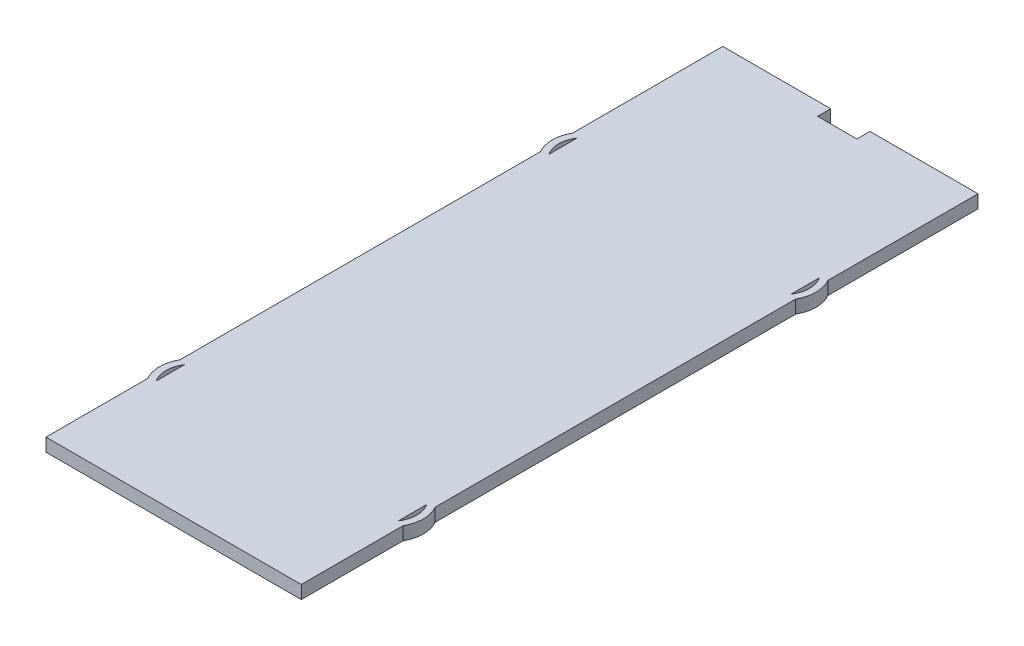
from build123d import *

# Parameters (mm, degrees)
SKETCH1_R             = 4.95
BOSS_EXTRUDE1_DEPTH   = 2
BOSS_EXTRUDE1_2_DEPTH = 2
BOSS_EXTRUDE1_3_DEPTH = 2
BOSS_EXTRUDE1_4_DEPTH = 2
SKETCH2_W             = 39
SKETCH2_H             = 103.4
BOSS_EXTRUDE2_DEPTH   = 2
SKETCH3_W             = 6
SKETCH3_H             = 2
CUT_EXTRUDE1_DEPTH    = 88.767775977
CUT_EXTRUDE2_DEPTH    = 88.767775977


with BuildPart() as part:
    # Sketch1 → Boss-Extrude1 (new body)
    with BuildSketch(Plane(origin=(0, 0, 0), x_dir=(1, 0, 0), z_dir=(0, 1, 0))):
        with Locations(Location((-15.2, 60, 0), (0, 0, 270))):
            Circle(SKETCH1_R)
    extrude(amount=BOSS_EXTRUDE1_DEPTH)



with BuildPart() as body_2:
    # Sketch1 → Boss-Extrude1 2 (new body)
    with BuildSketch(Plane(origin=(0, 0, 0), x_dir=(1, 0, 0), z_dir=(0, 1, 0))):
        with Locations(Location((15.2, 60, 0), (0, 0, 270))):
            Circle(SKETCH1_R)
    extrude(amount=BOSS_EXTRUDE1_2_DEPTH)


with BuildPart() as body_3:
    # Sketch1 → Boss-Extrude1 3 (new body)
    with BuildSketch(Plane(origin=(0, 0, 0), x_dir=(1, 0, 0), z_dir=(0, 1, 0))):
        with Locations(Location((15.2, 0, 0), (0, 0, 270))):
            Circle(SKETCH1_R)
    extrude(amount=BOSS_EXTRUDE1_3_DEPTH)


with BuildPart() as body_4:
    # Sketch1 → Boss-Extrude1 4 (new body)
    with BuildSketch(Plane(origin=(0, 0, 0), x_dir=(1, 0, 0), z_dir=(0, 1, 0))):
        with Locations(Location((-15.2, 0, 0), (0, 0, 270))):
            Circle(SKETCH1_R)
    extrude(amount=BOSS_EXTRUDE1_4_DEPTH)


with BuildPart() as part_1:
    add(part.part)

    add(body_2.part)  # Boss-Extrude2 merges body 2

    add(body_3.part)  # Boss-Extrude2 merges body 3

    add(body_4.part)  # Boss-Extrude2 merges body 4
    # Sketch2 → Boss-Extrude2 (add)
    with BuildSketch(Plane(origin=(0, 2, 0), x_dir=(1, 0, 0), z_dir=(0, 1, 0))):
        with Locations((0, 33.7)):
            Rectangle(SKETCH2_W, SKETCH2_H)
    extrude(amount=-BOSS_EXTRUDE2_DEPTH)

    # Sketch3 → Cut-Extrude1 (cut, through all)
    with BuildSketch(Plane(origin=(0, 2, 0), x_dir=(1, 0, 0), z_dir=(0, 1, 0))):
        with Locations((0, 84.4)):
            Rectangle(SKETCH3_W, SKETCH3_H)
    extrude(amount=-CUT_EXTRUDE1_DEPTH, mode=Mode.SUBTRACT)

    # Sketch5 → Cut-Extrude2 (cut, through all)
    with BuildSketch(Plane.XZ):
        with BuildLine():
            Line((18.5, -62.170829335), (18.5, -57.829170665))
            ThreePointArc((18.5, -57.829170665), (19.15, -60), (18.5, -62.170829335))
        make_face()
        with BuildLine():
            Line((18.5, -2.170829335), (18.5, 2.170829335))
            ThreePointArc((18.5, 2.170829335), (19.15, 0), (18.5, -2.170829335))
        make_face()
        with BuildLine():
            Line((-18.5, -2.170829335), (-18.5, 2.170829335))
            ThreePointArc((-18.5, 2.170829335), (-19.15, 0), (-18.5, -2.170829335))
        make_face()
        with BuildLine():
            Line((-18.5, -62.170829335), (-18.5, -57.829170665))
            ThreePointArc((-18.5, -57.829170665), (-19.15, -60), (-18.5, -62.170829335))
        make_face()
    extrude(amount=-CUT_EXTRUDE2_DEPTH, mode=Mode.SUBTRACT)


solid = part_1.part
